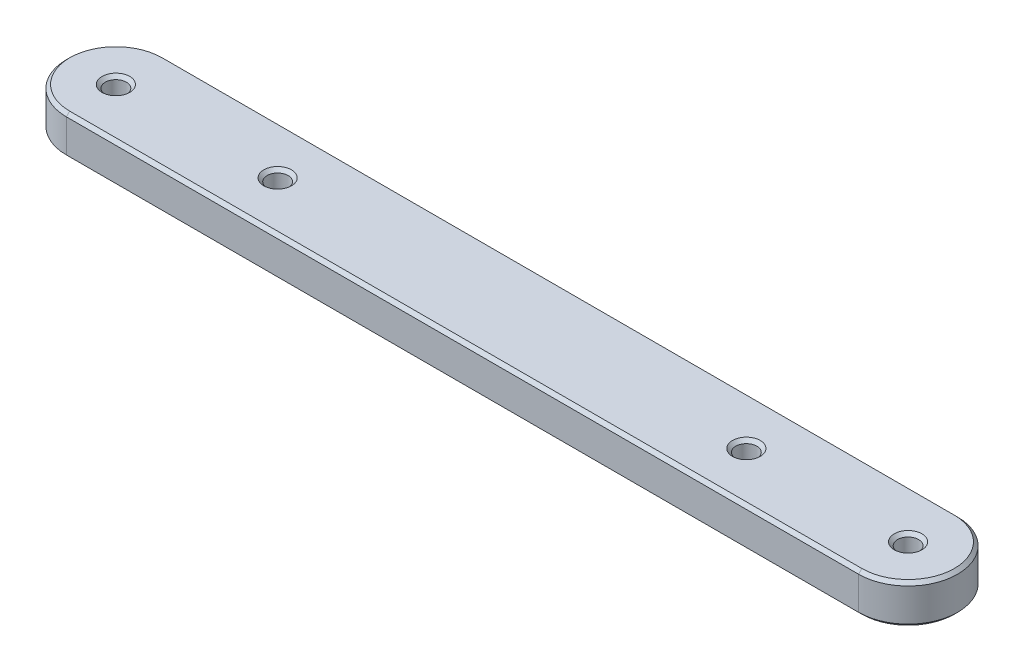
from build123d import *

# Parameters (mm, degrees)
SKETCH1_R           = 1.6
BOSS_EXTRUDE1_DEPTH = 3
CHAMFER1_SIZE       = 0.5


with BuildPart() as part:
    # Sketch1 → Boss-Extrude1 (new, symmetric)
    with BuildSketch(Plane(origin=(0, 0, 0), x_dir=(1, 0, 0), z_dir=(0, 1, 0))):
        with BuildLine():
            Line((0, 7.5), (120, 7.5))
            ThreePointArc((120, 7.5), (127.5, 0), (120, -7.5))
            Line((120, -7.5), (0, -7.5))
            ThreePointArc((0, -7.5), (-7.5, 0), (0, 7.5))
        make_face()
        with Locations(Location((0, 0, 0), (0, 0, 270))):
            Circle(SKETCH1_R, mode=Mode.SUBTRACT)
        with Locations(Location((120, 0, 0), (0, 0, 270))):
            Circle(SKETCH1_R, mode=Mode.SUBTRACT)
        with Locations(Location((24.5, 0, 0), (0, 0, 270))):
            Circle(SKETCH1_R, mode=Mode.SUBTRACT)
        with Locations(Location((95.5, 0, 0), (0, 0, 270))):
            Circle(SKETCH1_R, mode=Mode.SUBTRACT)
    extrude(amount=BOSS_EXTRUDE1_DEPTH, both=True)

    # Chamfer1
    chamfer1_edges = [part.edges().sort_by_distance(p)[0] for p in [
        (95.5, 3, -1.6),
        (-7.5, -3, 0),
        (60, -3, -7.5),
        (127.5, -3, 0),
        (60, -3, 7.5),
        (120, -3, -1.6),
        (0, -3, -1.6),
        (24.5, -3, -1.6),
        (95.5, -3, -1.6),
        (24.5, 3, -1.6),
        (0, 3, -1.6),
        (120, 3, -1.6),
        (60, 3, 7.5),
        (127.5, 3, 0),
        (60, 3, -7.5),
        (-7.5, 3, 0),
    ]]
    chamfer(chamfer1_edges, length=CHAMFER1_SIZE)


solid = part.part
